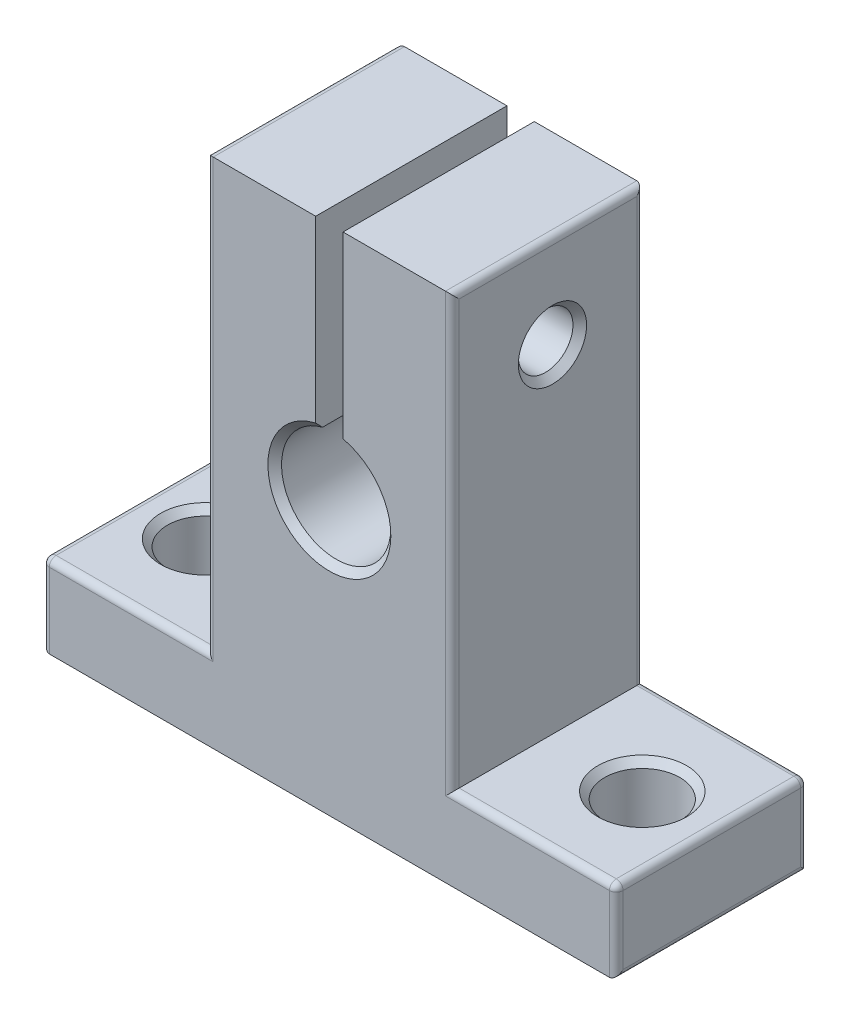
from build123d import *

# Parameters (mm, degrees)
BOSS_EXTRUDE1_DEPTH     = 7
SKETCH2_R               = 2.75
CUT_EXTRUDE1_DEPTH      = 39.5
CUT_EXTRUDE2_DEPTH      = 42.512046444
CUT_EXTRUDE2_DEPTH_BACK = 42.512046444
SKETCH5_R               = 2
CHAMFER2_SIZE           = 0.5
FILLET2_R               = 0.5


with BuildPart() as part:
    # Sketch1 → Boss-Extrude1 (new, symmetric)
    with BuildSketch(Plane.XY):
        with BuildLine():
            Line((-21, -3), (-21, 3))
            Line((-21, 3), (-9, 3))
            Line((-9, 3), (-9, 34.5))
            Line((-9, 34.5), (-1, 34.5))
            Line((-1, 34.5), (-1, 20.872983346))
            ThreePointArc((-1, 20.872983346), (0, 13), (1, 20.872983346))
            Line((1, 20.872983346), (1, 34.5))
            Line((1, 34.5), (9, 34.5))
            Line((9, 34.5), (9, 3))
            Line((9, 3), (21, 3))
            Line((21, 3), (21, -3))
            Line((21, -3), (-21, -3))
        make_face()
    extrude(amount=BOSS_EXTRUDE1_DEPTH, both=True)

    # Sketch2 → Cut-Extrude1 (cut, through all)
    with BuildSketch(Plane(origin=(0, 3, 0), x_dir=(1, 0, 0), z_dir=(0, 1, 0))):
        with Locations(Location((15.904501915, 0, 0), (0, 0, 180))):
            Circle(SKETCH2_R)
        with Locations((-16.095498085, 0)):
            Circle(SKETCH2_R)
    extrude(amount=-CUT_EXTRUDE1_DEPTH, mode=Mode.SUBTRACT)

    # Sketch5 → Cut-Extrude2 (cut, two sides: drawn at the far end of the back side and taken through both)
    with BuildSketch(Plane(origin=(-1, 0, 0), x_dir=(0, 0, -1), z_dir=(1, 0, 0)).offset(-CUT_EXTRUDE2_DEPTH_BACK)):
        with Locations((0.330734984, 27.686491673)):
            Circle(SKETCH5_R)
    extrude(amount=CUT_EXTRUDE2_DEPTH + CUT_EXTRUDE2_DEPTH_BACK, mode=Mode.SUBTRACT)

    # Chamfer2
    chamfer2_edges = [part.edges().sort_by_distance(p)[0] for p in [
        (0, 13, -7),
        (0, 13, 7),
        (18.654501915, 3, 0),
        (-18.845498085, 3, 0),
        (-9, 27.686491673, 1.669265016),
        (9, 27.686491673, 1.669265016),
    ]]
    chamfer(chamfer2_edges, length=CHAMFER2_SIZE)

    # Fillet2
    fillet2_edges = [part.edges().sort_by_distance(p)[0] for p in [
        (-15, 3, 7),
        (9, 18.75, -7),
        (15, 3, -7),
        (-21, 0, 7),
        (21, 0, -7),
        (-21, 0, -7),
        (-15, 3, -7),
        (-9, 18.75, -7),
        (21, 0, 7),
        (9, 34.5, 0),
        (21, 3, 0),
        (21, -3, 0),
        (-21, -3, 0),
        (-21, 3, 0),
        (-9, 34.5, 0),
        (15, 3, 7),
        (9, 18.75, 7),
        (-9, 18.75, 7),
    ]]
    fillet(fillet2_edges, radius=FILLET2_R)


solid = part.part
